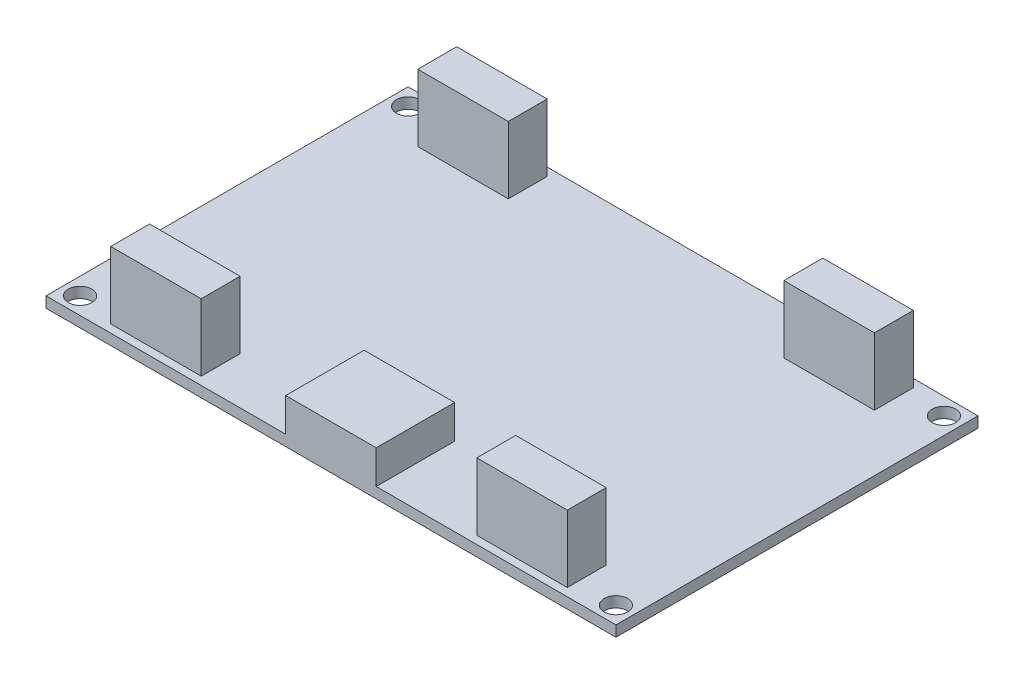
from build123d import *

# Parameters (mm, degrees)
SKETCH7_W                  = 85
SKETCH7_H                  = 54
BOSS_EXTRUDE2_DEPTH        = 1.6
F_3_5_3_5_DIAMETER_HOLE1_D = 3.5
SKETCH14_W                 = 13.5
SKETCH14_H                 = 5.8
BOSS_EXTRUDE3_DEPTH        = 10
LPATTERN1_COUNT            = 2
LPATTERN1_PITCH            = 54.6
LPATTERN1_COUNT_DIR2       = 2
LPATTERN1_PITCH_DIR2       = 45.8
SKETCH15_W                 = 13.5
SKETCH15_H                 = 11.7
BOSS_EXTRUDE4_DEPTH        = 5


with BuildPart() as part:
    # Sketch7 → Boss-Extrude2 (new body)
    with BuildSketch(Plane(origin=(0, 0, 0), x_dir=(1, 0, 0), z_dir=(0, 1, 0))):
        with Locations((42.5, 27)):
            Rectangle(SKETCH7_W, SKETCH7_H)
    extrude(amount=BOSS_EXTRUDE2_DEPTH)

    # Ø3.5 (3.5) Diameter Hole1 (through all)
    with Locations(Plane(origin=(0, 1.6, 0), x_dir=(-1, 0, 0), z_dir=(0, 1, 0))):
        with Locations((-2.54, -2.54), (-2.54, -51.46), (-82.46, -51.46), (-82.46, -2.54)):
            Hole(F_3_5_3_5_DIAMETER_HOLE1_D / 2)

    # Sketch14 → Boss-Extrude3 (add)
    with BuildSketch(Plane(origin=(0, 1.6, 0), x_dir=(1, 0, 0), z_dir=(0, 1, 0))):
        with Locations((15.2, 49.9)):
            Rectangle(SKETCH14_W, SKETCH14_H)
    boss_extrude3 = extrude(amount=BOSS_EXTRUDE3_DEPTH)

    # LPattern1: Boss-Extrude3 2 × 2
    with Locations(*[(i * LPATTERN1_PITCH, 0, j * LPATTERN1_PITCH_DIR2) for i in range(LPATTERN1_COUNT) for j in range(LPATTERN1_COUNT_DIR2) if (i, j) != (0, 0)]):
        add(boss_extrude3)

    # Sketch15 → Boss-Extrude4 (add)
    with BuildSketch(Plane(origin=(0, 1.6, 0), x_dir=(1, 0, 0), z_dir=(0, 1, 0))):
        with Locations((42.5, 5.85)):
            Rectangle(SKETCH15_W, SKETCH15_H)
    extrude(amount=BOSS_EXTRUDE4_DEPTH)


solid = part.part
